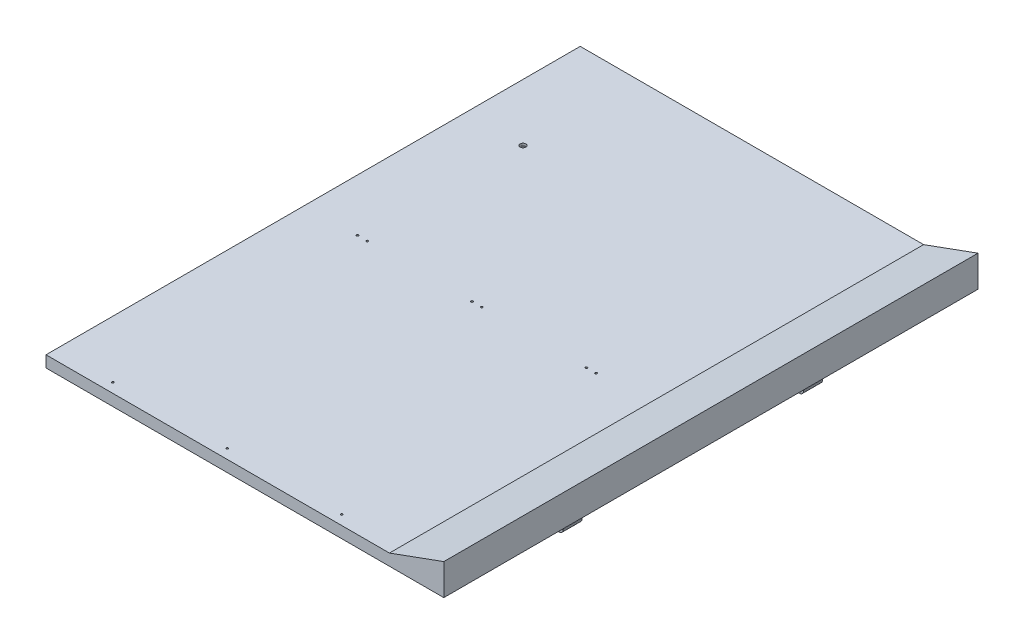
from build123d import *

# Parameters (mm, degrees)
BOSS_EXTRUDE1_DEPTH      = 1100
BOSS_EXTRUDE1_DEPTH_BACK = 300
SKETCH3_R                = 7.5
BOSS_EXTRUDE2_DEPTH      = 800
SKETCH5_R                = 7.5
CUT_EXTRUDE2_DEPTH       = 1519.191769837
SKETCH9_W                = 580
SKETCH9_H                = 60
SKETCH9_W_2              = 60
CUT_EXTRUDE5_DEPTH       = 1486.505638628
SKETCH6_W                = 25
SKETCH6_H                = 32
BOSS_EXTRUDE3_DEPTH      = 37.5
SKETCH7_W                = 16
SKETCH7_H                = 32.5
CUT_EXTRUDE3_DEPTH       = 1507.17537239
SKETCH8_W                = 16
SKETCH8_H                = 64
CUT_EXTRUDE4_DEPTH       = 24
SKETCH10_R               = 2.5908
CUT_EXTRUDE6_DEPTH       = 20


with BuildPart() as part:
    # Sketch2 → Boss-Extrude1 (new, two sides: drawn at the far end of the back side and taken through both)
    with BuildSketch(Plane.XY.offset(-BOSS_EXTRUDE1_DEPTH_BACK)):
        Polygon((0, 0), (0, 81.865758383), (-142.5, 30), (-1042.5, 30), (-1042.5, 0), align=None)
    extrude(amount=BOSS_EXTRUDE1_DEPTH + BOSS_EXTRUDE1_DEPTH_BACK)

    # Sketch3 → Boss-Extrude2 (add)
    # profile 1 of 2: a face of its own
    with BuildSketch(Plane.XY):
        with BuildLine():
            Line((-47.5, 0), (-47.5, -50))
            ThreePointArc((-47.5, -50), (-50.428932188, -57.071067812), (-57.5, -60))
            Line((-57.5, -60), (-512.5, -60))
            ThreePointArc((-512.5, -60), (-519.571067812, -57.071067812), (-522.5, -50))
            Line((-522.5, -50), (-522.5, 0))
            Line((-522.5, 0), (-47.5, 0))
        make_face()
        with BuildLine():
            Line((-510, -42.5), (-60, -42.5))
            ThreePointArc((-60, -42.5), (-52.5, -50), (-60, -57.5))
            Line((-60, -57.5), (-510, -57.5))
            ThreePointArc((-510, -57.5), (-517.5, -50), (-510, -42.5))
        make_face(mode=Mode.SUBTRACT)
    # profile 2 of 2: a face of its own
    with BuildSketch(Plane.XY):
        with BuildLine():
            Line((-1022.5, 0), (-1022.5, -50))
            ThreePointArc((-1022.5, -50), (-1019.571067812, -57.071067812), (-1012.5, -60))
            Line((-1012.5, -60), (-1007.5, -60))
            ThreePointArc((-1007.5, -60), (-1000.428932188, -57.071067812), (-997.5, -50))
            Line((-997.5, -50), (-997.5, 0))
            Line((-997.5, 0), (-1022.5, 0))
        make_face()
        with Locations((-1010, -50)):
            Circle(SKETCH3_R, mode=Mode.SUBTRACT)
    extrude(amount=BOSS_EXTRUDE2_DEPTH)

    # Sketch5 → Cut-Extrude2 (cut, through all)
    with BuildSketch(Plane(origin=(0, 30, 0), x_dir=(1, 0, 0), z_dir=(0, 1, 0))):
        with Locations(Location((-892.5, 0, 0), (0, 0, 180))):
            Circle(SKETCH5_R)
    extrude(amount=-CUT_EXTRUDE2_DEPTH, mode=Mode.SUBTRACT)

    # Sketch9 → Cut-Extrude5 (cut, through all)
    with BuildSketch(Plane(origin=(-47.5, 0, 0), x_dir=(0, 0, -1), z_dir=(1, 0, 0))):
        with Locations((-400, -30)):
            Rectangle(SKETCH9_W, SKETCH9_H)
        Polygon((-740, -50), (-740, -60), (-800, -60), (-800, -50), (-800, 0), (-740, 0), align=None)
        with Locations((-30, -30)):
            Rectangle(SKETCH9_W_2, SKETCH9_H)
    extrude(amount=-CUT_EXTRUDE5_DEPTH, mode=Mode.SUBTRACT)

    # Sketch6 → Boss-Extrude3 (add)
    with BuildSketch(Plane.XZ):
        with Locations((-892.5, 0)):
            Rectangle(SKETCH6_W, SKETCH6_H)
    extrude(amount=BOSS_EXTRUDE3_DEPTH)

    # Sketch7 → Cut-Extrude3 (cut, through all)
    with BuildSketch(Plane.XY.offset(16)):
        with Locations((-892.5, -16.25)):
            Rectangle(SKETCH7_W, SKETCH7_H)
    extrude(amount=-CUT_EXTRUDE3_DEPTH, mode=Mode.SUBTRACT)

    # Sketch8 → Cut-Extrude4 (cut)
    with BuildSketch(Plane.XZ):
        with Locations((-892.5, 0)):
            Rectangle(SKETCH8_W, SKETCH8_H)
    extrude(amount=-CUT_EXTRUDE4_DEPTH, mode=Mode.SUBTRACT)

    # Sketch10 → Cut-Extrude6 (cut)
    with BuildSketch(Plane(origin=(0, 30, 0), x_dir=(1, 0, 0), z_dir=(0, 1, 0))):
        with Locations(Location((-892.5, -1075, 0), (0, 0, 180))):
            Circle(SKETCH10_R)
        with Locations(Location((-592.5, -1075, 0), (0, 0, 180))):
            Circle(SKETCH10_R)
        with Locations(Location((-292.5, -1075, 0), (0, 0, 180))):
            Circle(SKETCH10_R)
        with Locations(Location((-905.2, -420.95, 0), (0, 0, 180))):
            Circle(SKETCH10_R)
        with Locations(Location((-879.8, -420.95, 0), (0, 0, 180))):
            Circle(SKETCH10_R)
        with Locations(Location((-605.2, -420.95, 0), (0, 0, 180))):
            Circle(SKETCH10_R)
        with Locations(Location((-579.8, -420.95, 0), (0, 0, 180))):
            Circle(SKETCH10_R)
        with Locations(Location((-305.2, -420.95, 0), (0, 0, 180))):
            Circle(SKETCH10_R)
        with Locations(Location((-279.8, -420.95, 0), (0, 0, 180))):
            Circle(SKETCH10_R)
    extrude(amount=-CUT_EXTRUDE6_DEPTH, mode=Mode.SUBTRACT)


solid = part.part
